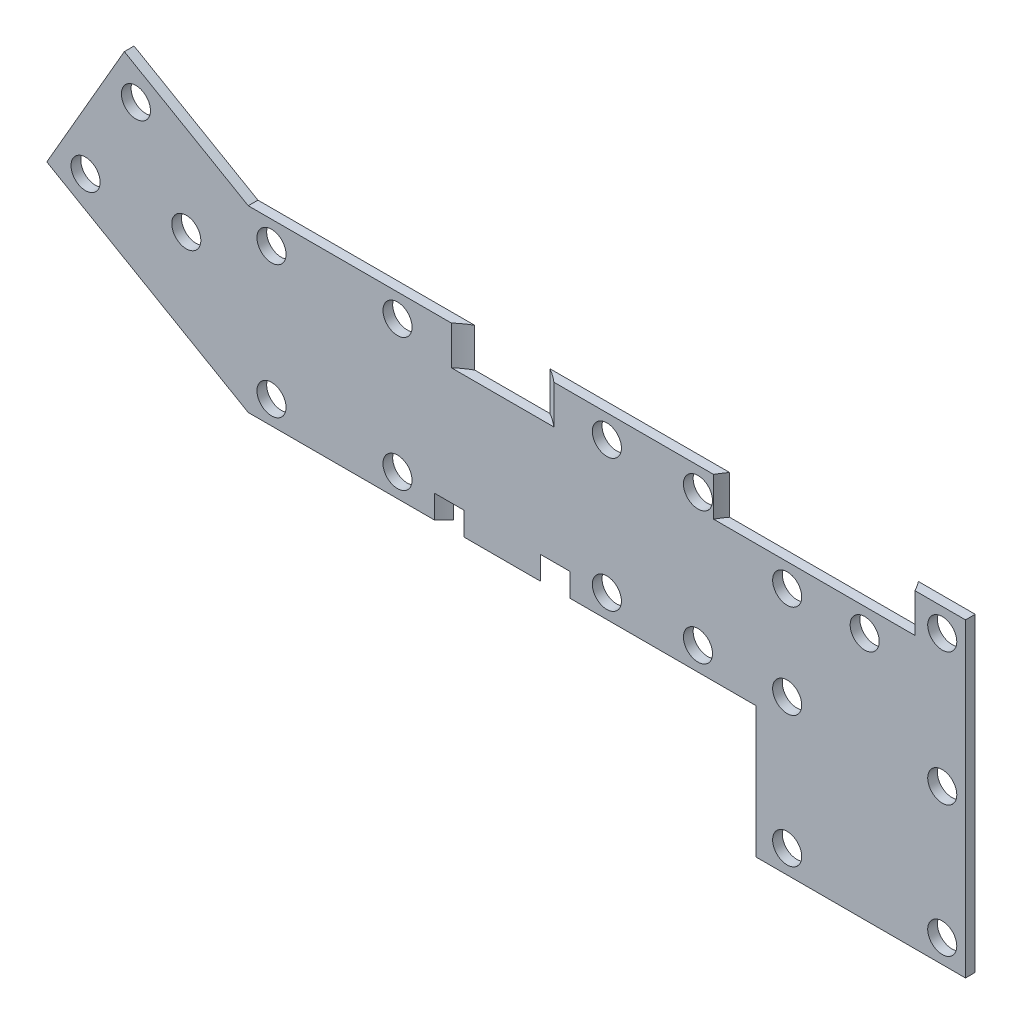
from build123d import *

# Parameters (mm, degrees)
SKETCH1_R           = 4.7625
BOSS_EXTRUDE1_DEPTH = 3.175
SKETCH2_R           = 29.21
SKETCH2_R_2         = 22.86
CUT_EXTRUDE1_DEPTH  = 7.62
SKETCH5_R           = 38.1
SKETCH5_R_2         = 25.4
CUT_EXTRUDE5_DEPTH  = 12.7


with BuildPart() as part:
    # Sketch1 → Boss-Extrude1 (new body)
    with BuildSketch(Plane.XY):
        Polygon((0, 0), (-40.591135768, 23.435303163), (-65.991135768, -20.55878735), (0, -58.65878735), (64.135, -58.65878735), (64.135, -51.03878735), (70.612, -51.03878735), (70.612, -58.65878735), (95.758, -58.65878735), (95.758, -51.03878735), (102.235, -51.03878735), (102.235, -58.65878735), (166.37, -58.65878735), (166.37, -101.6), (234.95, -101.6), (234.95, 0), align=None)
        with Locations((-20.295567884, -17.611742094)):
            Circle(SKETCH1_R, mode=Mode.SUBTRACT)
        with Locations((-53.291135768, -17.611742094)):
            Circle(SKETCH1_R, mode=Mode.SUBTRACT)
        with Locations((-36.793351826, 10.963257906)):
            Circle(SKETCH1_R, mode=Mode.SUBTRACT)
        with Locations((7.62, -51.03878735)):
            Circle(SKETCH1_R, mode=Mode.SUBTRACT)
        with Locations((7.62, -7.62)):
            Circle(SKETCH1_R, mode=Mode.SUBTRACT)
        with Locations((48.895, -7.62)):
            Circle(SKETCH1_R, mode=Mode.SUBTRACT)
        with Locations((117.475, -7.62)):
            Circle(SKETCH1_R, mode=Mode.SUBTRACT)
        with Locations((147.32, -7.62)):
            Circle(SKETCH1_R, mode=Mode.SUBTRACT)
        with Locations((117.475, -51.03878735)):
            Circle(SKETCH1_R, mode=Mode.SUBTRACT)
        with Locations((48.895, -51.03878735)):
            Circle(SKETCH1_R, mode=Mode.SUBTRACT)
        with Locations((147.32, -51.03878735)):
            Circle(SKETCH1_R, mode=Mode.SUBTRACT)
        with Locations((176.53, -20.32)):
            Circle(SKETCH1_R, mode=Mode.SUBTRACT)
        with Locations((201.93, -20.32)):
            Circle(SKETCH1_R, mode=Mode.SUBTRACT)
        with Locations((227.33, -7.62)):
            Circle(SKETCH1_R, mode=Mode.SUBTRACT)
        with Locations((227.33, -93.98)):
            Circle(SKETCH1_R, mode=Mode.SUBTRACT)
        with Locations((176.53, -93.98)):
            Circle(SKETCH1_R, mode=Mode.SUBTRACT)
        with Locations((227.33, -51.03878735)):
            Circle(SKETCH1_R, mode=Mode.SUBTRACT)
        with Locations((176.53, -51.03878735)):
            Circle(SKETCH1_R, mode=Mode.SUBTRACT)
    extrude(amount=BOSS_EXTRUDE1_DEPTH)

    # Sketch2 → Cut-Extrude1 (cut)
    with BuildSketch(Plane.XZ.offset(58.65878735)):
        with Locations((83.185, 22.225)):
            Circle(SKETCH2_R)
        with Locations((83.185, 22.225)):
            Circle(SKETCH2_R_2, mode=Mode.SUBTRACT)
    extrude(amount=-CUT_EXTRUDE1_DEPTH, mode=Mode.SUBTRACT)

    # Sketch5 → Cut-Extrude5 (cut)
    with BuildSketch(Plane(origin=(0, 0, 0), x_dir=(1, 0, 0), z_dir=(0, 1, 0))):
        with Locations((185.42, -22.225)):
            Circle(SKETCH5_R)
        with Locations((83.312, -22.225)):
            Circle(SKETCH5_R_2)
    extrude(amount=-CUT_EXTRUDE5_DEPTH, mode=Mode.SUBTRACT)


solid = part.part
